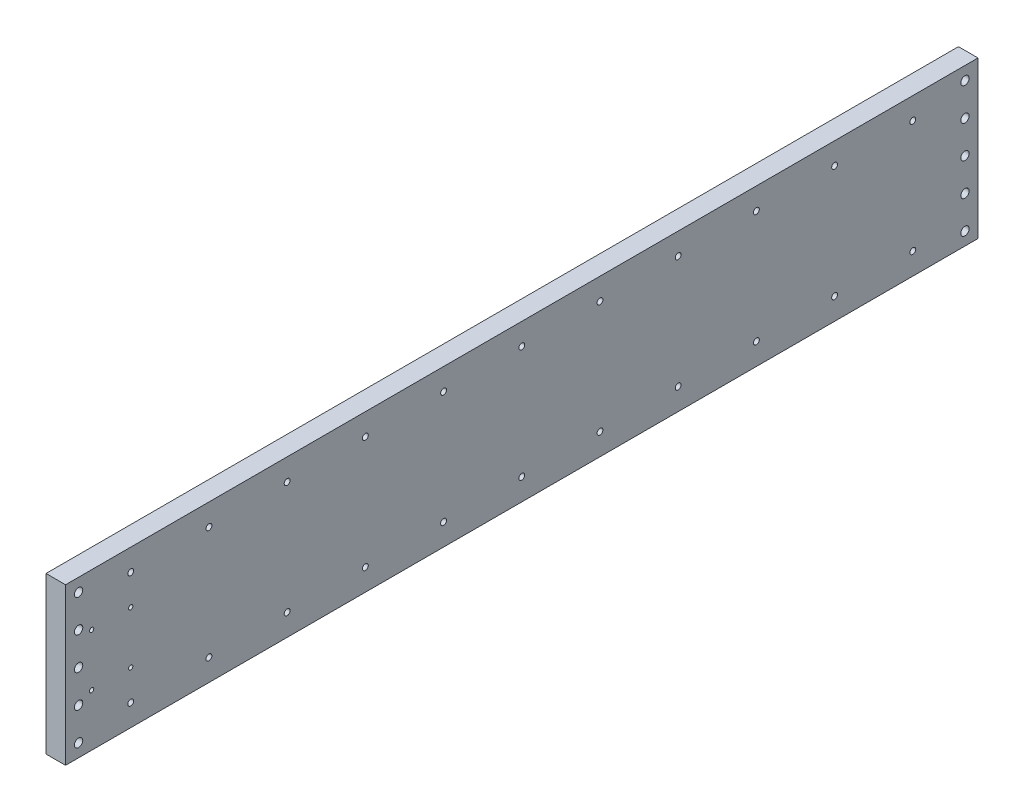
from build123d import *

# Parameters (mm, degrees)
SKETCH2_W                      = 15
SKETCH2_H                      = 120
BOSS_EXTRUDE1_DEPTH            = 700
F_4_5_4_5_DIAMETER_HOLE1_D     = 4.5
M4_TAPPED_HOLE3_D              = 3.3
CBORE_FOR_M6_SHCS1_D           = 6.4
CBORE_FOR_M6_SHCS1_CBORE_D     = 11
CBORE_FOR_M6_SHCS1_CBORE_DEPTH = 6


with BuildPart() as part:
    # Sketch2 → Boss-Extrude1 (new body)
    with BuildSketch(Plane.XY):
        with Locations((-7.5, -60)):
            Rectangle(SKETCH2_W, SKETCH2_H)
    extrude(amount=BOSS_EXTRUDE1_DEPTH)

    # Ø4.5 (4.5) Diameter Hole1 (through all)
    with Locations(Plane(origin=(0, -16.7, 650), x_dir=(0, 0, 1), z_dir=(1, 0, 0))):
        with Locations((0, 0), (-60, 0), (-120, 0), (-180, 0), (-240, 0), (-300, 0), (-360, 0), (-420, 0), (-480, 0), (-540, 0), (-600, 0), (0, 86.6), (-60, 86.6), (-120, 86.6), (-180, 86.6), (-240, 86.6), (-300, 86.6), (-360, 86.6), (-420, 86.6), (-480, 86.6), (-540, 86.6), (-600, 86.6)):
            Hole(F_4_5_4_5_DIAMETER_HOLE1_D / 2)

    # M4 Tapped Hole3 (through all)
    with Locations(Plane(origin=(0, -40, 680), x_dir=(0, 0, 1), z_dir=(1, 0, 0))):
        with Locations((0, 0), (-30, 0), (0, 40), (-30, 40)):
            Hole(M4_TAPPED_HOLE3_D / 2)

    # CBORE for M6 SHCS1 (through all)
    with Locations(Plane(origin=(-15, -10, 690), x_dir=(0, 0, -1), z_dir=(-1, 0, 0))):
        with Locations((0, 0), (0, 50), (0, 25), (0, 75), (0, 100), (680, 0), (680, 25), (680, 50), (680, 75), (680, 100)):
            CounterBoreHole(CBORE_FOR_M6_SHCS1_D / 2, CBORE_FOR_M6_SHCS1_CBORE_D / 2, CBORE_FOR_M6_SHCS1_CBORE_DEPTH)


solid = part.part
